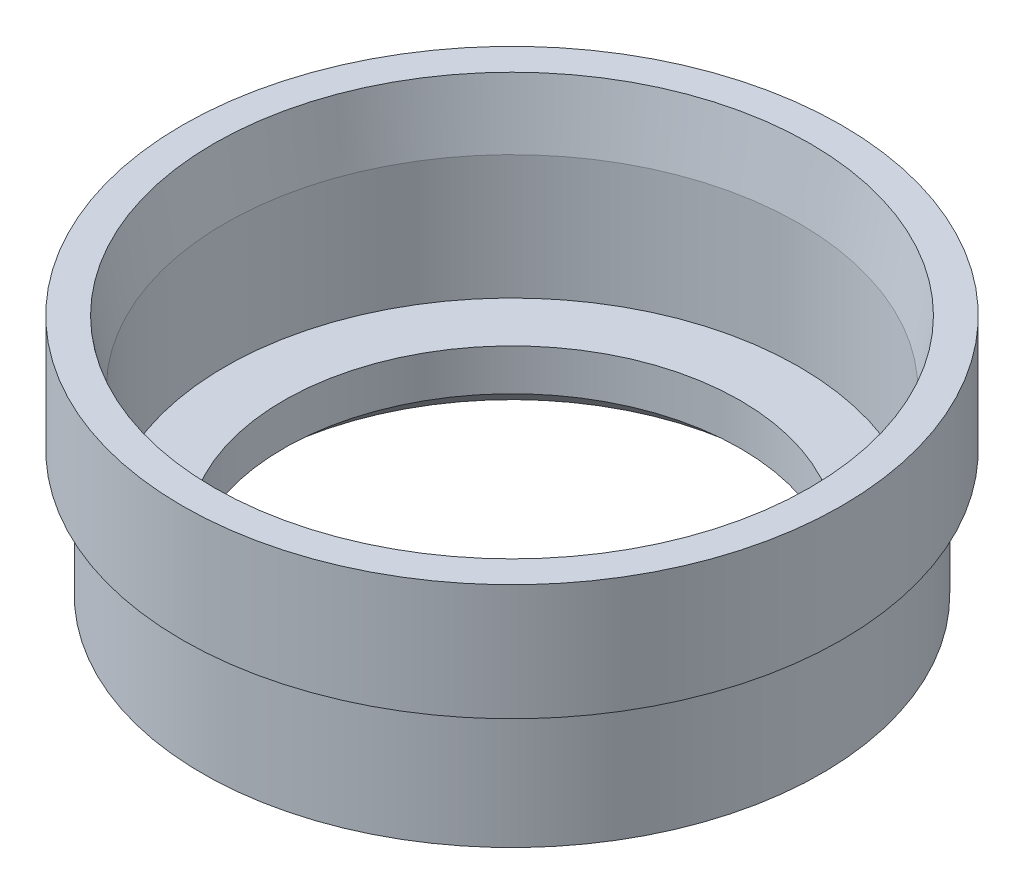
from build123d import *


with BuildPart() as part:
    # Sketch2 → Revolve1 (revolve)
    with BuildSketch(Plane.XY, mode=Mode.PRIVATE) as revolve1_sk:
        Polygon((0, 8.639461868), (0, 5.245589646), (2.296170187, 3.205597118), (3.796170187, 3.205597118), (3.796170187, 4.205597118), (6.65, 4.205597118), (6.65, 14.505597118), (8.3, 14.505597118), (8.3, 24.014413354), (6.65, 24.014413354), (5.705888238, 24.014413354), (4.8, 18.810277156), (4.8, 8.639461868), align=None)
    revolve(revolve1_sk.sketch.rotate(Axis((-18.7, 7.436212611, 0), (0, 1, 0)), 90), axis=Axis((-18.7, 7.436212611, 0), (0, 1, 0)))


solid = part.part
